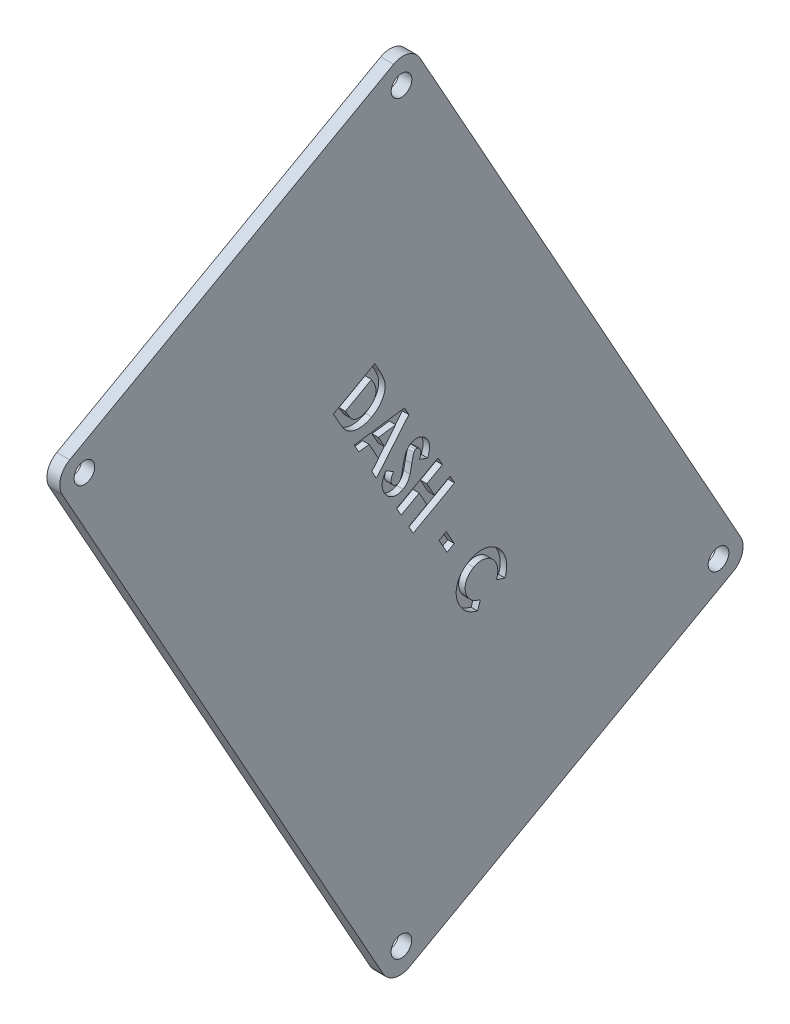
from build123d import *

# Parameters (mm, degrees)
SKETCH1_R           = 1.6
BASE_DEPTH          = 2
INSIDE_DEPTH        = 1
CUT_EXTRUDE1_DEPTH  = 1
BOSS_EXTRUDE3_START = -1
BOSS_EXTRUDE3_DEPTH = 0.254


with BuildPart() as part:
    # Sketch1 → BASE (new body)
    with BuildSketch(Plane(origin=(0, 0, 0), x_dir=(0, -1, 0), z_dir=(1, 0, 0))):
        with BuildLine():
            Line((-13.322750075, 84.673416811), (75.886878076, 134.414967301))
            ThreePointArc((75.886878076, 134.414967301), (77.311739154, 136.215480796), (77.046112783, 138.496165029))
            Line((77.046112783, 138.496165029), (49.043967167, 188.716975864))
            ThreePointArc((49.043967167, 188.716975864), (47.243453672, 190.141836942), (44.962769439, 189.876210571))
            Line((44.962769439, 189.876210571), (-44.246858711, 140.134660081))
            ThreePointArc((-44.246858711, 140.134660081), (-45.67171979, 138.334146585), (-45.406093419, 136.053462353))
            Line((-45.406093419, 136.053462353), (-17.403947803, 85.832651518))
            ThreePointArc((-17.403947803, 85.832651518), (-15.603434308, 84.407790439), (-13.322750075, 84.673416811))
        make_face()
        with Locations(Location((46.191904008, 186.439754808, 0), (0, 0, 90))):
            Circle(SKETCH1_R, mode=Mode.SUBTRACT)
        with Locations(Location((73.60965702, 137.26703046, 0), (0, 0, 90))):
            Circle(SKETCH1_R, mode=Mode.SUBTRACT)
        with Locations(Location((-14.551884644, 88.109872574, 0), (0, 0, 90))):
            Circle(SKETCH1_R, mode=Mode.SUBTRACT)
        with Locations(Location((-41.969637656, 137.282596922, 0), (0, 0, 90))):
            Circle(SKETCH1_R, mode=Mode.SUBTRACT)
    extrude(amount=BASE_DEPTH)

    # Sketch1<3> → Inside (add)
    with BuildSketch(Plane(origin=(0, 0, 0), x_dir=(0, -1, 0), z_dir=(1, 0, 0))):
        with BuildLine():
            Line((66.390364306, 153.089344215), (60.451207547, 149.777786125))
            Line((60.451207547, 149.777786125), (49.917575099, 168.669465706))
            Line((49.917575099, 168.669465706), (55.856731858, 171.981023796))
            Line((55.856731858, 171.981023796), (50.555687444, 181.488250579))
            ThreePointArc((50.555687444, 181.488250579), (49.158151691, 182.721145699), (47.296349999, 182.803795642))
            ThreePointArc((47.296349999, 182.803795642), (45.153613893, 182.784354196), (43.341037937, 183.927273436))
            ThreePointArc((43.341037937, 183.927273436), (41.713782191, 184.835665032), (39.876817036, 184.521506509))
            Line((39.876817036, 184.521506509), (-37.018133427, 141.646380357))
            ThreePointArc((-37.018133427, 141.646380357), (-38.251028546, 140.248844605), (-38.33367849, 138.387042912))
            ThreePointArc((-38.33367849, 138.387042912), (-38.314237043, 136.244306807), (-39.457156284, 134.43173085))
            ThreePointArc((-39.457156284, 134.43173085), (-40.365547879, 132.804475104), (-40.051389356, 130.96750995))
            Line((-40.051389356, 130.96750995), (-18.915668079, 93.061376803))
            ThreePointArc((-18.915668079, 93.061376803), (-17.518132327, 91.828481683), (-15.656330634, 91.745831739))
            ThreePointArc((-15.656330634, 91.745831739), (-13.513594529, 91.765273186), (-11.701018573, 90.622353946))
            ThreePointArc((-11.701018573, 90.622353946), (-10.073762826, 89.71396235), (-8.236797672, 90.028120873))
            Line((-8.236797672, 90.028120873), (68.658152791, 132.903247025))
            ThreePointArc((68.658152791, 132.903247025), (69.891047911, 134.300782777), (69.973697854, 136.16258447))
            ThreePointArc((69.973697854, 136.16258447), (69.954256408, 138.305320575), (71.097175648, 140.117896531))
            ThreePointArc((71.097175648, 140.117896531), (72.005567244, 141.745152278), (71.691408721, 143.582117432))
            Line((71.691408721, 143.582117432), (66.390364306, 153.089344215))
        make_face()
    extrude(amount=-INSIDE_DEPTH)

    # Sketch2 → Cut-Extrude1 (cut)
    # profile 1 of 6: a face of its own
    with BuildSketch(Plane(origin=(2, 0, 0), x_dir=(0, -1, 0), z_dir=(1, 0, 0))):
        with BuildLine():
            Line((-6.673324537, 133.134750728), (-5.224900392, 133.940585063))
            add(Edge.make_bspline(
                [(-5.224900392, 133.940585063), (-5.111525573, 134.002193759), (-4.892009611, 134.121480319), (-4.567079094, 134.282043626), (-4.258325113, 134.419211922), (-3.965834846, 134.532860616), (-3.689250395, 134.622278658), (-3.429824503, 134.690012606), (-3.186290726, 134.734683012), (-2.956201344, 134.753673929), (-2.734225217, 134.754399118), (-2.515557801, 134.733794405), (-2.295929742, 134.698995745), (-2.077041435, 134.643109771), (-1.857693563, 134.57179634), (-1.638364067, 134.482204086), (-1.419881537, 134.373406231), (-1.201343306, 134.249555618), (-0.988911929, 134.106691081), (-0.781812018, 133.950780457), (-0.587621648, 133.774773205), (-0.399489688, 133.587145873), (-0.22323886, 133.38042513), (-0.053320873, 133.160332968), (0.103599184, 132.921428481), (0.200535957, 132.754801919), (0.249727346, 132.670245854)],
                knots=[0, 0, 0, 0, 1.44082689, 2.789724414, 4.046123481, 5.212554733, 6.29218165, 7.290355882, 8.204930784, 9.053169798, 9.865218537, 10.680436533, 11.503236902, 12.345971738, 13.200215455, 14.077302246, 14.988919433, 15.924197467, 16.880241016, 17.845891847, 18.816161271, 19.804426868, 20.811049067, 21.847425636, 22.907657846, 24, 24, 24, 24], degree=3))
            add(Edge.make_bspline(
                [(0.249727346, 132.670245854), (0.314543935, 132.5477458), (0.442045207, 132.306774888), (0.587838883, 131.930506357), (0.697952657, 131.553293063), (0.767270705, 131.17580535), (0.799104671, 130.803957617), (0.792265529, 130.442731764), (0.746785132, 130.094482285), (0.661271419, 129.763213178), (0.546714927, 129.451391978), (0.401507185, 129.164837776), (0.232049414, 128.903179154), (0.065866941, 128.703334006), (-0.092139967, 128.552677282), (-0.235480049, 128.431043594), (-0.404302133, 128.300525741), (-0.601384845, 128.165099297), (-0.822572206, 128.019664711), (-1.06907916, 127.865116713), (-1.342306161, 127.703445919), (-1.534835068, 127.595880361), (-1.635004892, 127.539915659)],
                knots=[0, 0, 0, 0, 1.31826101, 2.593162588, 3.833087869, 5.054056018, 6.240093167, 7.379864954, 8.486682412, 9.575066353, 10.6299207, 11.642837299, 12.626299491, 13.592153751, 14.108341734, 14.70284469, 15.380976686, 16.138610081, 16.978374675, 17.900769967, 18.907802954, 20, 20, 20, 20], degree=3))
            Line((-1.635004892, 127.539915659), (-3.104205614, 126.722208995))
            Line((-3.104205614, 126.722208995), (-6.673324537, 133.134750728))
        make_face()
        with BuildLine():
            Line((-4.800464628, 132.634628866), (-2.552142312, 128.593584863))
            Line((-2.552142312, 128.593584863), (-1.9852386, 128.909685624))
            add(Edge.make_bspline(
                [(-1.9852386, 128.909685624), (-1.918233678, 128.94788761), (-1.789092047, 129.021516032), (-1.605973107, 129.134140293), (-1.440754472, 129.24575801), (-1.29275356, 129.354619842), (-1.16243316, 129.461621284), (-1.05065527, 129.567497658), (-0.955132152, 129.670184764), (-0.853195709, 129.806295036), (-0.753631703, 129.987572708), (-0.671870654, 130.226067194), (-0.624324228, 130.48708596), (-0.617231681, 130.718893144), (-0.628721217, 130.912607465), (-0.647835785, 131.063501698), (-0.679889143, 131.216411804), (-0.720770623, 131.372391969), (-0.775385029, 131.529944042), (-0.838600091, 131.690421806), (-0.915005793, 131.852425366), (-0.972168079, 131.959628777), (-1.001319329, 132.014299673)],
                knots=[0, 0, 0, 0, 1.226598621, 2.364079254, 3.417987389, 4.396684454, 5.28511832, 6.097611482, 6.843791558, 7.512501609, 8.79776818, 10.113940086, 11.505785792, 13.001563543, 13.78969607, 14.590835862, 15.417825493, 16.272745511, 17.153447786, 18.067971168, 19.014716553, 20, 20, 20, 20], degree=3))
            add(Edge.make_bspline(
                [(-1.001319329, 132.014299673), (-1.048876456, 132.096329497), (-1.141425548, 132.255964577), (-1.300291359, 132.474412244), (-1.466468845, 132.67048402), (-1.643233695, 132.842376756), (-1.831340071, 132.988491739), (-2.028552851, 133.111185793), (-2.235143934, 133.211162845), (-2.380317949, 133.256229452), (-2.452711556, 133.278702718)],
                knots=[0, 0, 0, 0, 1.150033336, 2.238035557, 3.272724783, 4.26620552, 5.224490895, 6.157392268, 7.08115085, 8, 8, 8, 8], degree=3))
            add(Edge.make_bspline(
                [(-2.452711556, 133.278702718), (-2.520666836, 133.294454143), (-2.658283311, 133.326352408), (-2.875217242, 133.339416652), (-3.101941056, 133.326451078), (-3.339941928, 133.289636332), (-3.587836505, 133.222292147), (-3.845734536, 133.129215483), (-4.115850046, 133.012416492), (-4.294121045, 132.916037503), (-4.386417152, 132.866139283)],
                knots=[0, 0, 0, 0, 0.825115747, 1.670944793, 2.56285204, 3.511779837, 4.518079977, 5.600460408, 6.757688211, 8, 8, 8, 8], degree=3))
            Line((-4.386417152, 132.866139283), (-4.800464628, 132.634628866))
        make_face(mode=Mode.SUBTRACT)
    # profile 2 of 6: a face of its own
    with BuildSketch(Plane(origin=(2, 0, 0), x_dir=(0, -1, 0), z_dir=(1, 0, 0))):
        Polygon((1.58127419, 137.734889453), (2.818964495, 138.423484538), (8.854559781, 133.383680852), (7.587188653, 132.678761315), (6.35098239, 133.72055819), (3.734617873, 132.264713839), (3.946835755, 130.653045169), (2.677980587, 129.94664159), align=None)
        Polygon((3.155841832, 136.384412022), (3.525368074, 133.707201819), (5.229047294, 134.655504103), align=None, mode=Mode.SUBTRACT)
    # profile 3 of 6: a face of its own
    with BuildSketch(Plane(origin=(2, 0, 0), x_dir=(0, -1, 0), z_dir=(1, 0, 0))):
        with BuildLine():
            Line((10.109814718, 141.347651718), (9.652730049, 140.046147644))
            add(Edge.make_bspline(
                [(9.652730049, 140.046147644), (9.584387557, 140.076840884), (9.453370151, 140.135682002), (9.258352613, 140.204239095), (9.074395184, 140.252988831), (8.900821535, 140.280991522), (8.737744181, 140.285242163), (8.585713196, 140.27161838), (8.443823342, 140.234984901), (8.358061219, 140.193049269), (8.315608989, 140.172291141)],
                knots=[0, 0, 0, 0, 1.290056813, 2.473130457, 3.556106009, 4.564795781, 5.493939688, 6.358771685, 7.187592362, 8, 8, 8, 8], degree=3))
            add(Edge.make_bspline(
                [(8.315608989, 140.172291141), (8.277968517, 140.149940275), (8.205304002, 140.106792174), (8.116064877, 140.021016486), (8.042171592, 139.928940733), (7.993094475, 139.82649161), (7.962349484, 139.723998653), (7.955180083, 139.625154865), (7.964680277, 139.531599087), (7.990937487, 139.47676121), (8.003960351, 139.449563109)],
                knots=[0, 0, 0, 0, 1.204846471, 2.325942852, 3.396990621, 4.447724404, 5.442167293, 6.332672322, 7.173050668, 8, 8, 8, 8], degree=3))
            add(Edge.make_bspline(
                [(8.003960351, 139.449563109), (8.019874993, 139.423653608), (8.051950183, 139.371434263), (8.1172356, 139.304898258), (8.193580265, 139.247174469), (8.2517239, 139.219074896), (8.281476043, 139.204696322)],
                knots=[0, 0, 0, 0, 0.966085415, 1.947098355, 2.949528667, 4, 4, 4, 4], degree=3))
            add(Edge.make_bspline(
                [(8.281476043, 139.204696322), (8.3071192, 139.195065986), (8.36674904, 139.172671888), (8.470395013, 139.140964343), (8.600029592, 139.105270617), (8.756197587, 139.067439539), (8.938530816, 139.023980914), (9.147438596, 138.978566899), (9.382369799, 138.929343081), (9.547819291, 138.896815651), (9.634921555, 138.879691314)],
                knots=[0, 0, 0, 0, 0.471794677, 1.097097404, 1.866198342, 2.78802505, 3.864961944, 5.09525194, 6.470771172, 8, 8, 8, 8], degree=3))
            add(Edge.make_bspline(
                [(9.634921555, 138.879691314), (9.716048872, 138.863861187), (9.869923605, 138.833836078), (10.088742753, 138.791144804), (10.282533922, 138.750937395), (10.451705862, 138.715287358), (10.596369208, 138.684561617), (10.715959922, 138.656276442), (10.811513144, 138.632782281), (10.86670011, 138.617603817), (10.890420353, 138.611079869)],
                knots=[0, 0, 0, 0, 1.544789737, 2.930013207, 4.166577891, 5.243622258, 6.161172352, 6.930351436, 7.540247895, 8, 8, 8, 8], degree=3))
            add(Edge.make_bspline(
                [(10.890420353, 138.611079869), (10.982445563, 138.58286164), (11.159351748, 138.528615858), (11.405796917, 138.427221599), (11.624541153, 138.317025221), (11.814723572, 138.19185366), (11.983107923, 138.05218118), (12.135074293, 137.896077494), (12.271061076, 137.719943642), (12.347558836, 137.5914011), (12.386333815, 137.526245802)],
                knots=[0, 0, 0, 0, 1.213992793, 2.333739156, 3.358289954, 4.300093818, 5.200009157, 6.113759584, 7.043907525, 8, 8, 8, 8], degree=3))
            add(Edge.make_bspline(
                [(12.386333815, 137.526245802), (12.420227278, 137.461038251), (12.48693224, 137.332704741), (12.564029221, 137.133288311), (12.619405172, 136.932896681), (12.654261381, 136.731592856), (12.66604996, 136.529012084), (12.655645287, 136.325447068), (12.621968786, 136.121312899), (12.569430308, 135.917711511), (12.494887951, 135.718989164), (12.401781273, 135.528573845), (12.28787651, 135.349265594), (12.154560168, 135.180749345), (12.002745751, 135.021545023), (11.831491177, 134.872826434), (11.640136844, 134.735640887), (11.502511982, 134.654559072), (11.432095367, 134.613073058)],
                knots=[0, 0, 0, 0, 1.02549645, 2.018256446, 2.978405948, 3.924264219, 4.865217575, 5.805790621, 6.764149818, 7.749191446, 8.73703795, 9.722394315, 10.703456745, 11.696937263, 12.717958188, 13.77054269, 14.859284319, 16, 16, 16, 16], degree=3))
            add(Edge.make_bspline(
                [(11.432095367, 134.613073058), (11.375544969, 134.583211598), (11.263553499, 134.524074456), (11.091847027, 134.448277437), (10.919022191, 134.387433205), (10.746493729, 134.339569675), (10.573393637, 134.305305491), (10.399778074, 134.283850403), (10.225564672, 134.279022231), (10.050891465, 134.283982979), (9.875153063, 134.305152563), (9.69828732, 134.341403143), (9.519123152, 134.390458501), (9.337806469, 134.454859294), (9.153786144, 134.53342216), (8.968554422, 134.627699709), (8.780413143, 134.734531465), (8.657493968, 134.815190682), (8.594608721, 134.856455804)],
                knots=[0, 0, 0, 0, 1.015949185, 2.011968939, 2.979033912, 3.924879035, 4.854416681, 5.780625027, 6.700810277, 7.620995528, 8.555008905, 9.509210833, 10.487455385, 11.50422522, 12.564192357, 13.664457361, 14.805140262, 16, 16, 16, 16], degree=3))
            Line((8.594608721, 134.856455804), (9.275783601, 136.046656792))
            add(Edge.make_bspline(
                [(9.275783601, 136.046656792), (9.351257103, 136.00086968), (9.495805514, 135.913177257), (9.714158836, 135.807445481), (9.921974138, 135.729365393), (10.120530403, 135.682658708), (10.309374435, 135.663566212), (10.488315419, 135.673385127), (10.658268419, 135.712410078), (10.760625355, 135.763104881), (10.811766173, 135.788433635)],
                knots=[0, 0, 0, 0, 1.294570168, 2.479387538, 3.55397778, 4.545134259, 5.463750378, 6.328917177, 7.165073259, 8, 8, 8, 8], degree=3))
            add(Edge.make_bspline(
                [(10.811766173, 135.788433635), (10.861000746, 135.818392668), (10.956693845, 135.87662152), (11.076904936, 135.990904991), (11.174058026, 136.119139497), (11.240557335, 136.261790335), (11.284020347, 136.406497353), (11.292892513, 136.548740429), (11.273589256, 136.68486787), (11.234948726, 136.765663411), (11.215425361, 136.806485852)],
                knots=[0, 0, 0, 0, 1.138342148, 2.212499894, 3.262582175, 4.305328829, 5.313120937, 6.235769455, 7.108611731, 8, 8, 8, 8], degree=3))
            add(Edge.make_bspline(
                [(11.215425361, 136.806485852), (11.193487969, 136.842106664), (11.148920541, 136.914472963), (11.055286659, 137.006950842), (10.942110401, 137.087467329), (10.831887647, 137.144849745), (10.728746031, 137.187779314), (10.633146938, 137.219487019), (10.522709805, 137.254116651), (10.395036731, 137.286058566), (10.251964033, 137.319700252), (10.09260585, 137.356485887), (9.916460205, 137.389104139), (9.793709694, 137.411963804), (9.729900188, 137.423846963)],
                knots=[0, 0, 0, 0, 0.905451473, 1.839491286, 2.831956477, 3.91280702, 4.529056815, 5.255821241, 6.098262577, 7.041150222, 8.111708758, 9.289324127, 10.590906985, 12, 12, 12, 12], degree=3))
            add(Edge.make_bspline(
                [(9.729900188, 137.423846963), (9.608110604, 137.446092637), (9.373509682, 137.488944049), (9.037656246, 137.558736521), (8.731783166, 137.628096283), (8.455953326, 137.697643895), (8.209711012, 137.768179534), (7.99326501, 137.840366265), (7.806839574, 137.912763377), (7.646687745, 137.986253842), (7.5079921, 138.065664375), (7.381379481, 138.147046521), (7.264695188, 138.233614957), (7.157436653, 138.325740663), (7.059641711, 138.423864998), (6.970393744, 138.526089484), (6.890405892, 138.6332001), (6.846186872, 138.709555384), (6.82414765, 138.747611654)],
                knots=[0, 0, 0, 0, 1.800994685, 3.46922128, 4.989771277, 6.363394796, 7.606933173, 8.715199576, 9.681392771, 10.515242155, 11.275747015, 12.004325301, 12.703819687, 13.387589725, 14.05928644, 14.717312969, 15.3606954, 16, 16, 16, 16], degree=3))
            add(Edge.make_bspline(
                [(6.82414765, 138.747611654), (6.795243355, 138.802949725), (6.738199987, 138.912160831), (6.674170333, 139.08455462), (6.630277633, 139.259849773), (6.601995349, 139.437689043), (6.597560235, 139.618396833), (6.608334173, 139.80204961), (6.642674908, 139.988075284), (6.692439813, 140.175457742), (6.759633606, 140.35919571), (6.844817736, 140.534154656), (6.946375767, 140.697754147), (7.062159079, 140.851201108), (7.193977646, 140.993334084), (7.341855231, 141.124087634), (7.504865135, 141.245039545), (7.623343908, 141.314116674), (7.683407466, 141.349135759)],
                knots=[0, 0, 0, 0, 0.982108433, 1.938216227, 2.886362422, 3.823604661, 4.766395052, 5.72626937, 6.714656073, 7.738484762, 8.775730482, 9.789230282, 10.796307294, 11.802450503, 12.810881498, 13.842381634, 14.906181814, 16, 16, 16, 16], degree=3))
            add(Edge.make_bspline(
                [(7.683407466, 141.349135759), (7.764048204, 141.390951896), (7.92409716, 141.47394505), (8.181588421, 141.558704799), (8.447149945, 141.616108464), (8.676779751, 141.636966352), (8.867842499, 141.637227319), (9.020519725, 141.626466479), (9.181489051, 141.605276558), (9.350876848, 141.573962793), (9.528779211, 141.531534108), (9.715980376, 141.482061071), (9.910359072, 141.418506606), (10.042149071, 141.371689352), (10.109814718, 141.347651718)],
                knots=[0, 0, 0, 0, 1.299542546, 2.57922277, 3.869125508, 5.185735066, 5.873169196, 6.604808814, 7.376603351, 8.198108926, 9.071386794, 9.996281258, 10.971219936, 12, 12, 12, 12], degree=3))
        make_face()
    # profile 4 of 6: a face of its own
    with BuildSketch(Plane(origin=(2, 0, 0), x_dir=(0, -1, 0), z_dir=(1, 0, 0))):
        Polygon((10.905683679, 142.936148437), (12.143373983, 143.624743523), (13.490883331, 141.205756477), (15.635322768, 142.398925547), (14.287813419, 144.817912593), (15.521051601, 145.505023638), (19.090170524, 139.092481904), (17.856932343, 138.40537086), (16.291268948, 141.217628806), (14.146829512, 140.024459735), (15.712492907, 137.212201789), (14.474802602, 136.523606704), align=None)
    # profile 5 of 6: a face of its own
    with BuildSketch(Plane(origin=(2, 0, 0), x_dir=(0, -1, 0), z_dir=(1, 0, 0))):
        Polygon((21.435680371, 144.226171037), (23.649869741, 145.457925177), (24.265746811, 144.350830492), (22.051557441, 143.119076352), align=None)
    # profile 6 of 6: a face of its own
    with BuildSketch(Plane(origin=(2, 0, 0), x_dir=(0, -1, 0), z_dir=(1, 0, 0))):
        with BuildLine():
            Line((32.198460065, 153.322705659), (31.796284918, 152.031589874))
            add(Edge.make_bspline(
                [(31.796284918, 152.031589874), (31.682990188, 152.064163239), (31.461389229, 152.127875725), (31.128113369, 152.189311256), (30.803537124, 152.215851884), (30.488108865, 152.213136438), (30.181775333, 152.173295917), (29.884313188, 152.103999297), (29.595969299, 151.99991881), (29.413973078, 151.906467815), (29.32238835, 151.859441103)],
                knots=[0, 0, 0, 0, 1.107899663, 2.16701718, 3.179736685, 4.165834046, 5.126913913, 6.077913965, 7.032761639, 8, 8, 8, 8], degree=3))
            add(Edge.make_bspline(
                [(29.32238835, 151.859441103), (29.248258411, 151.81582677), (29.102190873, 151.729887969), (28.902137627, 151.578774862), (28.720027392, 151.415425238), (28.561674221, 151.233896292), (28.419083367, 151.040978488), (28.298483258, 150.831782173), (28.199004591, 150.607663927), (28.119800973, 150.372121601), (28.061523475, 150.13033457), (28.029318936, 149.887179116), (28.018760072, 149.645952678), (28.038766333, 149.40655021), (28.076988998, 149.168271635), (28.145787158, 148.933270218), (28.236022059, 148.699201608), (28.314673122, 148.549316559), (28.354793532, 148.472859238)],
                knots=[0, 0, 0, 0, 1.050028865, 2.069003852, 3.057316764, 4.033525494, 5.006642428, 5.984178558, 6.977063775, 7.997650583, 9.016464248, 10.010526, 10.990282894, 11.959996883, 12.940666748, 13.933551964, 14.945891653, 16, 16, 16, 16], degree=3))
            add(Edge.make_bspline(
                [(28.354793532, 148.472859238), (28.384658502, 148.420411191), (28.443598686, 148.316902044), (28.545007006, 148.172109804), (28.647516682, 148.032982234), (28.75920375, 147.905451339), (28.877599601, 147.788005001), (28.99998195, 147.677106819), (29.131287232, 147.578747897), (29.266146969, 147.487066688), (29.407105641, 147.407786692), (29.550908889, 147.337363267), (29.698934418, 147.279233313), (29.850490734, 147.232386065), (30.004727917, 147.192939046), (30.163045044, 147.166030989), (30.324842443, 147.152317058), (30.54441697, 147.143252607), (30.821191526, 147.16310968), (31.1496064, 147.228214847), (31.472260799, 147.339124538), (31.676235389, 147.443356286), (31.779960466, 147.496360173)],
                knots=[0, 0, 0, 0, 0.906485738, 1.789000179, 2.654314151, 3.502600082, 4.3331432, 5.159784606, 5.982001853, 6.796418995, 7.608763868, 8.410046595, 9.201056041, 9.995759697, 10.792685527, 11.591965648, 12.405669981, 13.23137491, 14.892893595, 16.560753027, 18.251075503, 20, 20, 20, 20], degree=3))
            add(Edge.make_bspline(
                [(31.779960466, 147.496360173), (31.865739871, 147.546990808), (32.033899947, 147.646245999), (32.262580379, 147.82402335), (32.466743891, 148.018671336), (32.617984894, 148.197698344), (32.726114349, 148.353949661), (32.805426057, 148.481694212), (32.879330666, 148.622663064), (32.951233096, 148.774313932), (33.021781145, 148.937367384), (33.088424125, 149.112054911), (33.149903211, 149.299286559), (33.189057251, 149.428011805), (33.209092076, 149.493879537)],
                knots=[0, 0, 0, 0, 1.415634203, 2.775178411, 4.108931682, 5.422467891, 6.099786545, 6.810596323, 7.559760163, 8.362334996, 9.197557881, 10.086172836, 11.020709144, 12, 12, 12, 12], degree=3))
            Line((33.209092076, 149.493879537), (34.516532314, 149.093188432))
            add(Edge.make_bspline(
                [(34.516532314, 149.093188432), (34.489502273, 149.004916894), (34.436494749, 148.831811135), (34.347489994, 148.581932608), (34.253655352, 148.346412947), (34.156037822, 148.125443711), (34.054188638, 147.918299889), (33.944982161, 147.726822195), (33.83359854, 147.548074626), (33.712577835, 147.384607242), (33.585549329, 147.230743308), (33.449824824, 147.082588391), (33.302977559, 146.94115467), (33.146887806, 146.803310816), (32.978559853, 146.673843801), (32.80148159, 146.546678479), (32.613724077, 146.425392973), (32.4827482, 146.350108826), (32.416614112, 146.312095349)],
                knots=[0, 0, 0, 0, 1.233731397, 2.419420984, 3.544033642, 4.621480206, 5.647492371, 6.627481509, 7.566607302, 8.460542851, 9.343481678, 10.232538392, 11.144291468, 12.067290003, 13.014226431, 13.981102954, 14.98059155, 16, 16, 16, 16], degree=3))
            add(Edge.make_bspline(
                [(32.416614112, 146.312095349), (32.293083987, 146.246874721), (32.051279464, 146.119208349), (31.675661448, 145.971603441), (31.302411464, 145.858139817), (30.928322463, 145.78627743), (30.55478067, 145.75565657), (30.181719859, 145.760494902), (29.808835119, 145.807805525), (29.439365925, 145.891862148), (29.080794239, 146.012644174), (28.739889854, 146.168242839), (28.418930779, 146.355675315), (28.118900698, 146.57817529), (27.841254977, 146.83557086), (27.581321973, 147.122837351), (27.34390521, 147.445544087), (27.206555543, 147.679564341), (27.136395762, 147.799104564)],
                knots=[0, 0, 0, 0, 1.088548525, 2.130783541, 3.141305135, 4.127072581, 5.094833488, 6.059321528, 7.03107189, 8.020184711, 9.00947804, 9.976154354, 10.937435782, 11.902586992, 12.882662351, 13.885045026, 14.9196568, 16, 16, 16, 16], degree=3))
            add(Edge.make_bspline(
                [(27.136395762, 147.799104564), (27.093940854, 147.878788994), (27.010146589, 148.036064052), (26.901492644, 148.277202924), (26.810580769, 148.519549245), (26.737678392, 148.763020513), (26.682836165, 149.007579998), (26.643612307, 149.252379072), (26.623355609, 149.498415144), (26.61825801, 149.744847725), (26.632165689, 149.990254964), (26.661263627, 150.233910551), (26.710108629, 150.474415096), (26.771196079, 150.713477293), (26.85196715, 150.94901483), (26.951233754, 151.180549608), (27.063319282, 151.411422516), (27.193692112, 151.637237138), (27.338559329, 151.855314027), (27.494338918, 152.06452626), (27.664029154, 152.260359288), (27.845302351, 152.444372331), (28.037291494, 152.617202094), (28.240827814, 152.778329305), (28.458134197, 152.924920948), (28.609564948, 153.013826695), (28.685734705, 153.058546338)],
                knots=[0, 0, 0, 0, 1.062139026, 2.096369128, 3.109367824, 4.105623537, 5.084175166, 6.056405426, 7.020236433, 7.986594882, 8.954214575, 9.910068815, 10.871207134, 11.839666745, 12.811531056, 13.797446479, 14.802235008, 15.829563154, 16.862728112, 17.881313163, 18.896483349, 19.90898027, 20.918746526, 21.934133604, 22.960867996, 24, 24, 24, 24], degree=3))
            add(Edge.make_bspline(
                [(28.685734705, 153.058546338), (28.752046981, 153.094612351), (28.884130643, 153.166450199), (29.089962784, 153.257060539), (29.298567725, 153.339688076), (29.510926563, 153.410678234), (29.7279929, 153.469121773), (29.948716756, 153.514265347), (30.173395589, 153.550588572), (30.401332584, 153.574011998), (30.63065056, 153.585678413), (30.859092617, 153.586548021), (31.08579444, 153.571675686), (31.311617543, 153.549869864), (31.535527628, 153.509379144), (31.758850591, 153.461473026), (31.980215857, 153.398908194), (32.125492235, 153.348183236), (32.198460065, 153.322705659)],
                knots=[0, 0, 0, 0, 0.996843598, 1.985556233, 2.968571937, 3.960562178, 4.941860177, 5.936473313, 6.935692007, 7.94754704, 8.961868346, 9.968306014, 10.963412856, 11.962268162, 12.963621759, 13.967361056, 14.979068344, 16, 16, 16, 16], degree=3))
        make_face()
    extrude(amount=-CUT_EXTRUDE1_DEPTH, mode=Mode.SUBTRACT)

    # Sketch1<5> → Boss-Extrude3 (add)
    with BuildSketch(Plane(origin=(0, 0, 0), x_dir=(0, -1, 0), z_dir=(1, 0, 0)).offset(BOSS_EXTRUDE3_START)):
        Polygon((-11.201718071, 113.753804417), (-16.616713503, 110.73450847), (-22.558038312, 121.390054421), (-17.14304288, 124.409350368), align=None)
    extrude(amount=-BOSS_EXTRUDE3_DEPTH)


solid = part.part
